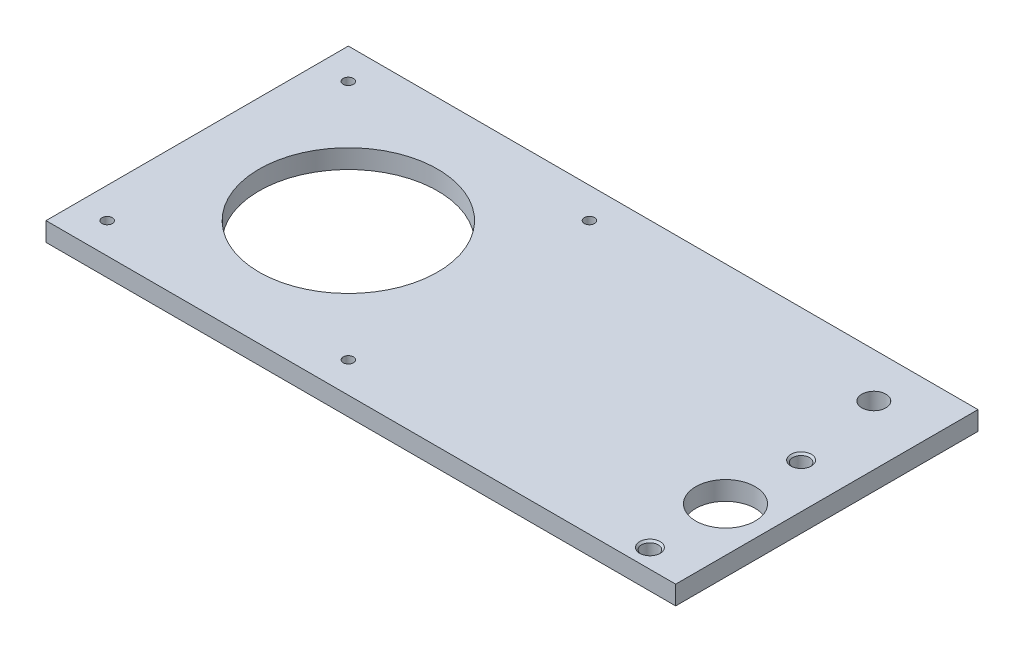
from build123d import *

# Parameters (mm, degrees)
SKETCH1_W                        = 211.6
SKETCH1_H                        = 101.6
SKETCH1_R                        = 30
SKETCH1_R_2                      = 4.025
SKETCH1_R_3                      = 10
BOSS_EXTRUDE1_DEPTH              = 6.35
F_8_32_TAPPED_HOLE1_D            = 3.4544
F_10_CLEARANCE_HOLE1_D           = 5.6134
F_10_CLEARANCE_HOLE1_CSINK_D     = 6.8834
F_10_CLEARANCE_HOLE1_CSINK_ANGLE = 90


with BuildPart() as part:
    # Sketch1 → Boss-Extrude1 (new body)
    with BuildSketch(Plane(origin=(0, 0, 0), x_dir=(1, 0, 0), z_dir=(0, 1, 0))):
        with Locations((55, 0)):
            Rectangle(SKETCH1_W, SKETCH1_H)
        with Locations(Location((0, 0, 0), (0, 0, 270))):
            Circle(SKETCH1_R, mode=Mode.SUBTRACT)
        with Locations(Location((140.8, 35.8, 0), (0, 0, 270))):
            Circle(SKETCH1_R_2, mode=Mode.SUBTRACT)
        with Locations(Location((145.8, -19.05, 0), (0, 0, 270))):
            Circle(SKETCH1_R_3, mode=Mode.SUBTRACT)
    extrude(amount=BOSS_EXTRUDE1_DEPTH)

    # #8-32 Tapped Hole1 (through all)
    with Locations(Plane(origin=(0, 6.35, 0), x_dir=(1, 0, 0), z_dir=(0, 1, 0))):
        with Locations((-40.513, 40.513), (40.513, 40.513), (40.513, -40.513), (-40.513, -40.513)):
            Hole(F_8_32_TAPPED_HOLE1_D / 2)

    # #10 Clearance Hole1 (through all)
    with Locations(Plane(origin=(0, 6.35, 0), x_dir=(1, 0, 0), z_dir=(0, 1, 0))):
        with Locations((145.8, 6.35), (145.8, -44.45)):
            CounterSinkHole(F_10_CLEARANCE_HOLE1_D / 2, F_10_CLEARANCE_HOLE1_CSINK_D / 2, counter_sink_angle=F_10_CLEARANCE_HOLE1_CSINK_ANGLE)


solid = part.part
